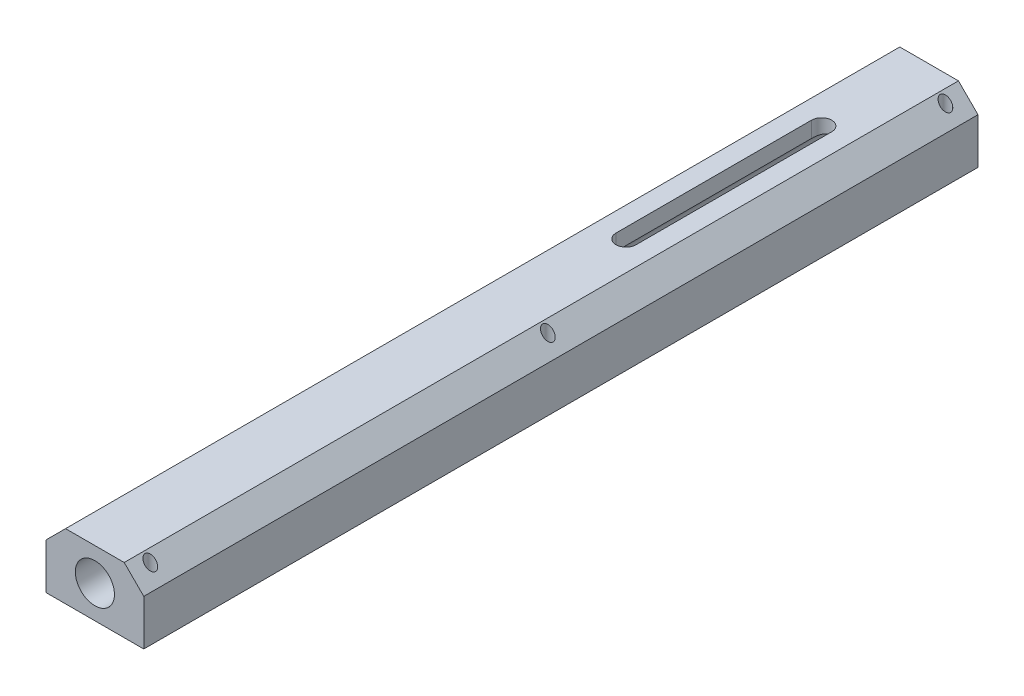
from build123d import *

# Parameters (mm, degrees)
ESQUISSE1_W                               = 15
ESQUISSE1_H                               = 10
BOSS_EXTRU_1_DEPTH                        = 128
ESQUISSE2_R                               = 3
ENL_V_MAT_EXTRU_1_DEPTH                   = 129.316990301
ENL_V_MAT_EXTRU_2_DEPTH                   = 129.608903269
CHANFREIN1_SIZE                           = 3
TROU_POUR_TARAUDAGE_POUR_TROU_TARAUD_M2_D = 1.6
R_P_TITION_LIN_AIRE1_COUNT                = 3
R_P_TITION_LIN_AIRE1_PITCH                = 61
R_P_TITION_LIN_AIRE1_COUNT_DIR2           = 2
R_P_TITION_LIN_AIRE1_PITCH_DIR2           = 11


with BuildPart() as part:
    # Esquisse1 → Boss.-Extru.1 (new body)
    with BuildSketch(Plane.XY):
        Rectangle(ESQUISSE1_W, ESQUISSE1_H)
    extrude(amount=BOSS_EXTRU_1_DEPTH)

    # Esquisse2 → Enlèv. mat.-Extru.1 (cut, through all)
    with BuildSketch(Plane.XY.offset(128)):
        Circle(ESQUISSE2_R)
    extrude(amount=-ENL_V_MAT_EXTRU_1_DEPTH, mode=Mode.SUBTRACT)

    # Esquisse3 → Enlèv. mat.-Extru.2 (cut, through all)
    with BuildSketch(Plane(origin=(0, 5, 0), x_dir=(1, 0, 0), z_dir=(0, 1, 0))):
        with BuildLine():
            Line((1.55, -16.5), (1.55, -46.5))
            ThreePointArc((1.55, -46.5), (0, -48.05), (-1.55, -46.5))
            Line((-1.55, -46.5), (-1.55, -16.5))
            ThreePointArc((-1.55, -16.5), (0, -14.95), (1.55, -16.5))
        make_face()
    extrude(amount=-ENL_V_MAT_EXTRU_2_DEPTH, mode=Mode.SUBTRACT)

    # Chanfrein1
    chanfrein1_edges = [part.edges().sort_by_distance(p)[0] for p in [
        (-7.5, 5, 64),
        (7.5, 5, 64),
    ]]
    chamfer(chanfrein1_edges, length=CHANFREIN1_SIZE)

    # Trou pour taraudage pour trou taraudé M21 (through all)
    with Locations(Plane(origin=(0, -5, 0), x_dir=(-1, 0, 0), z_dir=(0, -1, 0))):
        with Locations((5.5, -125)):
            trou_pour_taraudage_pour_trou_taraud_m2 = Hole(TROU_POUR_TARAUDAGE_POUR_TROU_TARAUD_M2_D / 2)

    # Répétition linéaire1: Trou pour taraudage pour trou taraud_ M2 3 × 2
    with Locations(*[(j * R_P_TITION_LIN_AIRE1_PITCH_DIR2, 0, -i * R_P_TITION_LIN_AIRE1_PITCH) for i in range(R_P_TITION_LIN_AIRE1_COUNT) for j in range(R_P_TITION_LIN_AIRE1_COUNT_DIR2) if (i, j) != (0, 0)]):
        add(trou_pour_taraudage_pour_trou_taraud_m2, mode=Mode.SUBTRACT)


solid = part.part
